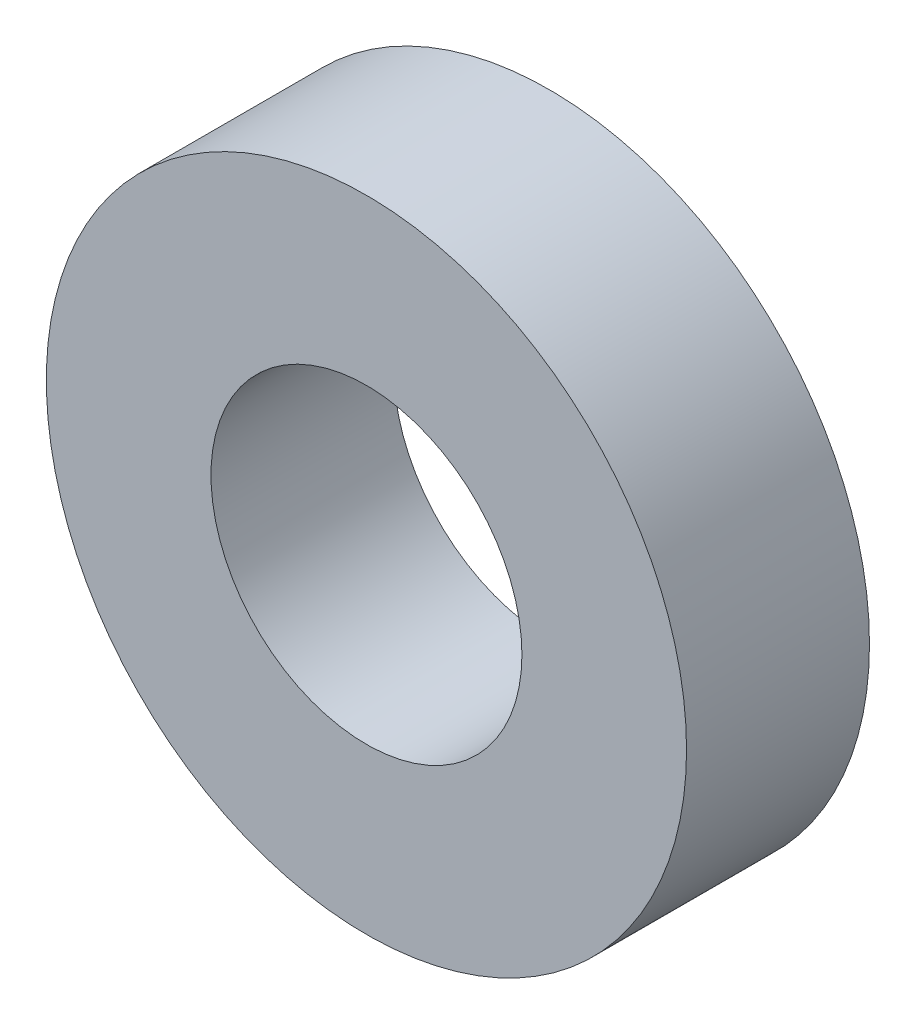
from build123d import *

# Parameters (mm, degrees)
REAR_BEARING_START = -42
SKETCH_1_R         = 17.5
SKETCH_1_R_2       = 8.5
REAR_BEARING_DEPTH = 10


with BuildPart() as part:
    # Эскиз1 → Rear_bearing (new body)
    with BuildSketch(Plane.XY.offset(REAR_BEARING_START)):
        Circle(SKETCH_1_R)
        Circle(SKETCH_1_R_2, mode=Mode.SUBTRACT)
    extrude(amount=REAR_BEARING_DEPTH)


solid = part.part
